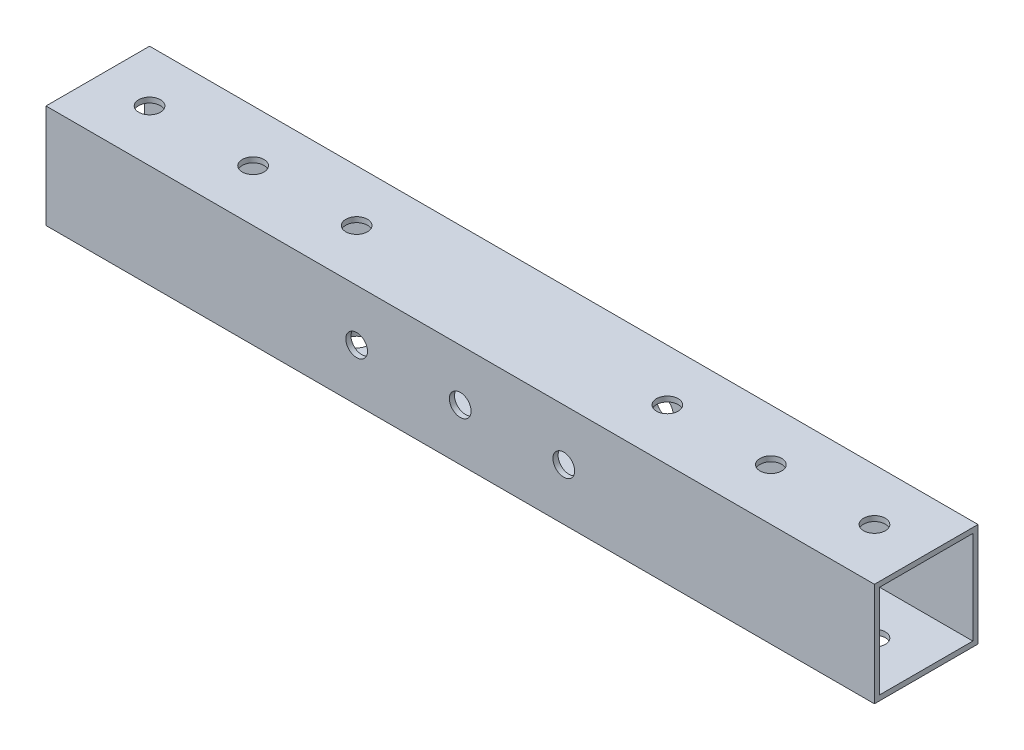
from build123d import *

# Parameters (mm, degrees)
SKETCH_1_W          = 20
SKETCH_1_H          = 20
EXTRUDE_1_DEPTH     = 160
SKETCH_2_R          = 2.1
CUT_EXTRUDE_1_DEPTH = 160
SKETCH_3_R          = 2.1
CUT_EXTRUDE_2_DEPTH = 162.554944214
SKETCH_4_W          = 18
SKETCH_4_H          = 18
CUT_EXTRUDE_3_DEPTH = 161.623784042


with BuildPart() as part:
    # 草图1 → 凸台-拉伸1 (new body)
    with BuildSketch(Plane(origin=(0, 0, 0), x_dir=(0, 0, -1), z_dir=(1, 0, 0))):
        Rectangle(SKETCH_1_W, SKETCH_1_H)
    extrude(amount=EXTRUDE_1_DEPTH)

    # 草图2 → 切除-拉伸1 (cut)
    with BuildSketch(Plane.XZ.offset(10)):
        with Locations(Location((10, 0, 0), (0, 0, 270))):
            Circle(SKETCH_2_R)
        with Locations(Location((30, 0, 0), (0, 0, 270))):
            Circle(SKETCH_2_R)
        with Locations(Location((50, 0, 0), (0, 0, 270))):
            Circle(SKETCH_2_R)
        with Locations(Location((110, 0, 0), (0, 0, 270))):
            Circle(SKETCH_2_R)
        with Locations(Location((130, 0, 0), (0, 0, 270))):
            Circle(SKETCH_2_R)
        with Locations(Location((150, 0, 0), (0, 0, 270))):
            Circle(SKETCH_2_R)
    extrude(amount=-CUT_EXTRUDE_1_DEPTH, mode=Mode.SUBTRACT)

    # 草图3 → 切除-拉伸2 (cut, through all)
    with BuildSketch(Plane.XY.offset(10)):
        with Locations((60, 0)):
            Circle(SKETCH_3_R)
        with Locations((80, 0)):
            Circle(SKETCH_3_R)
        with Locations((100, 0)):
            Circle(SKETCH_3_R)
    extrude(amount=-CUT_EXTRUDE_2_DEPTH, mode=Mode.SUBTRACT)

    # 草图4 → 切除-拉伸3 (cut, through all)
    with BuildSketch(Plane.ZY):
        Rectangle(SKETCH_4_W, SKETCH_4_H)
    extrude(amount=-CUT_EXTRUDE_3_DEPTH, mode=Mode.SUBTRACT)


solid = part.part
